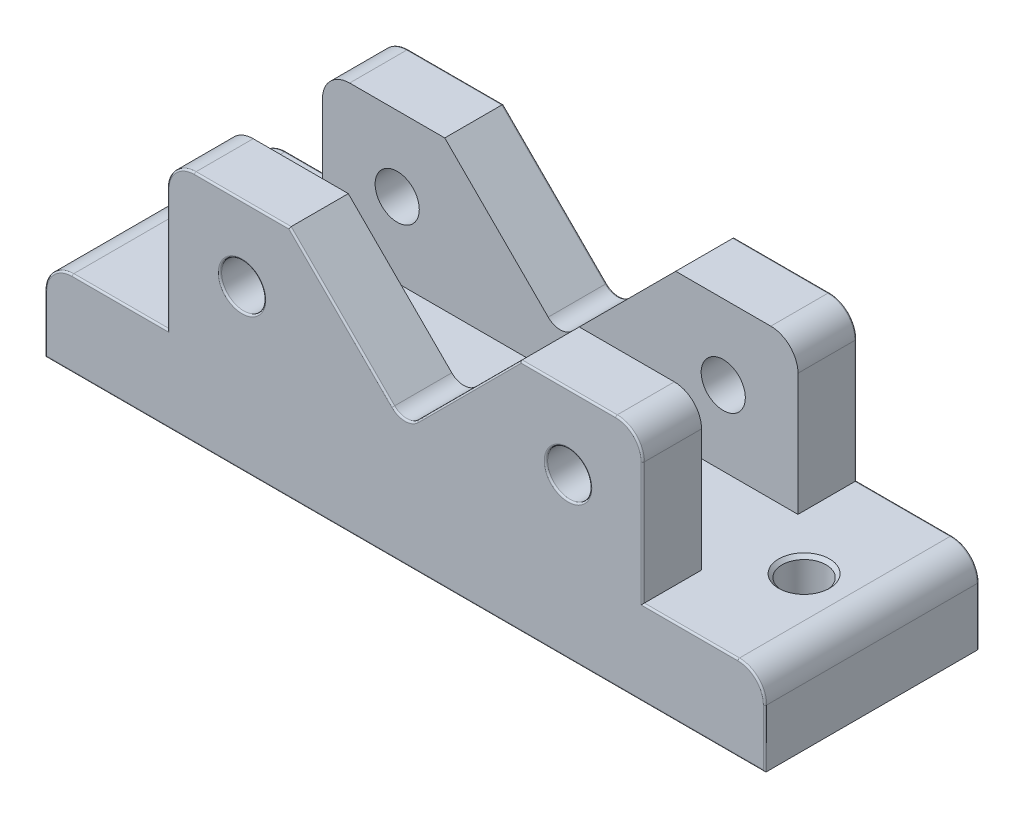
from build123d import *

# Parameters (mm, degrees)
BOSS_EXTRUDE1_DEPTH = 31.5
CUT_EXTRUDE1_REACH  = 193.649
SKETCH2_W           = 28.4
SKETCH2_H           = 44
SKETCH3_R           = 6.5
CUT_EXTRUDE2_DEPTH  = 232.676498592
SKETCH4_R           = 6.5
CUT_EXTRUDE3_DEPTH  = 219.797280605
FILLET1_R           = 0.5
CHAMFER1_SIZE       = 1


with BuildPart() as part:
    # Sketch1 → Boss-Extrude1 (new, symmetric)
    with BuildSketch(Plane.XY):
        with BuildLine():
            Line((0, 0), (0, 17))
            ThreePointArc((0, 17), (2.343145751, 22.656854249), (8, 25))
            Line((8, 25), (36, 25))
            Line((36, 25), (36, 61))
            ThreePointArc((36, 61), (38.343145751, 66.656854249), (44, 69))
            Line((44, 69), (72, 69))
            Line((72, 69), (102.464466094, 38.535533906))
            ThreePointArc((102.464466094, 38.535533906), (106, 37.071067812), (109.535533906, 38.535533906))
            Line((109.535533906, 38.535533906), (140, 69))
            Line((140, 69), (168, 69))
            ThreePointArc((168, 69), (173.656854249, 66.656854249), (176, 61))
            Line((176, 61), (176, 25))
            Line((176, 25), (204, 25))
            ThreePointArc((204, 25), (209.656854249, 22.656854249), (212, 17))
            Line((212, 17), (212, 0))
            Line((212, 0), (0, 0))
        make_face()
    extrude(amount=BOSS_EXTRUDE1_DEPTH, both=True)

    # Sketch2 → Cut-Extrude1 (cut, up to next)
    with BuildSketch(Plane(origin=(176, 0, 0), x_dir=(0, 0, -1), z_dir=(1, 0, 0)), mode=Mode.PRIVATE) as cut_extrude1_sk1:
        with Locations((0, 47)):
            Rectangle(SKETCH2_W, SKETCH2_H)
    cut_extrude1_tool1 = extrude(cut_extrude1_sk1.sketch, amount=-CUT_EXTRUDE1_REACH, mode=Mode.PRIVATE) & part.part
    add(cut_extrude1_tool1.solids().sort_by_distance((176, 47, 0))[0], mode=Mode.SUBTRACT)

    # Sketch3 → Cut-Extrude2 (cut, through all)
    with BuildSketch(Plane.XY.offset(31.5)):
        with Locations((58, 47)):
            Circle(SKETCH3_R)
        with Locations(Location((154, 47, 0), (0, 0, 90))):
            Circle(SKETCH3_R)
    extrude(amount=-CUT_EXTRUDE2_DEPTH, mode=Mode.SUBTRACT)

    # Sketch4 → Cut-Extrude3 (cut, through all)
    with BuildSketch(Plane(origin=(0, 25, 0), x_dir=(1, 0, 0), z_dir=(0, 1, 0))):
        with Locations(Location((20, 0, 0), (0, 0, 270))):
            Circle(SKETCH4_R)
        with Locations(Location((192, 0, 0), (0, 0, 270))):
            Circle(SKETCH4_R)
    extrude(amount=-CUT_EXTRUDE3_DEPTH, mode=Mode.SUBTRACT)

    # Fillet1
    fillet1_edges = [part.edges().sort_by_distance(p)[0] for p in [
        (209.656854249, 22.656854249, 31.5),
        (0, 8.5, -31.5),
        (2.343145751, 22.656854249, -31.5),
        (22, 25, -31.5),
        (190, 25, 31.5),
        (36, 43, -31.5),
        (38.343145751, 66.656854249, -31.5),
        (58, 69, -31.5),
        (87.232233047, 53.767766953, -31.5),
        (106, 37.071067812, -31.5),
        (124.767766953, 53.767766953, -31.5),
        (154, 69, -31.5),
        (173.656854249, 66.656854249, -31.5),
        (176, 43, -31.5),
        (190, 25, -31.5),
        (176, 43, 31.5),
        (209.656854249, 22.656854249, -31.5),
        (212, 8.5, -31.5),
        (106, 0, -31.5),
        (173.656854249, 66.656854249, 31.5),
        (154, 69, 31.5),
        (124.767766953, 53.767766953, 31.5),
        (106, 37.071067812, 31.5),
        (87.232233047, 53.767766953, 31.5),
        (58, 69, 31.5),
        (38.343145751, 66.656854249, 31.5),
        (106, 0, 31.5),
        (36, 43, 31.5),
        (22, 25, 31.5),
        (2.343145751, 22.656854249, 31.5),
        (0, 8.5, 31.5),
        (51.5, 47, -31.5),
        (51.5, 47, 31.5),
        (154, 40.5, -31.5),
        (154, 40.5, 31.5),
        (212, 8.5, 31.5),
    ]]
    fillet(fillet1_edges, radius=FILLET1_R)

    # Chamfer1
    chamfer1_edges = [part.edges().sort_by_distance(p)[0] for p in [
        (20, 25, -6.5),
        (192, 25, -6.5),
    ]]
    chamfer(chamfer1_edges, length=CHAMFER1_SIZE)


solid = part.part
